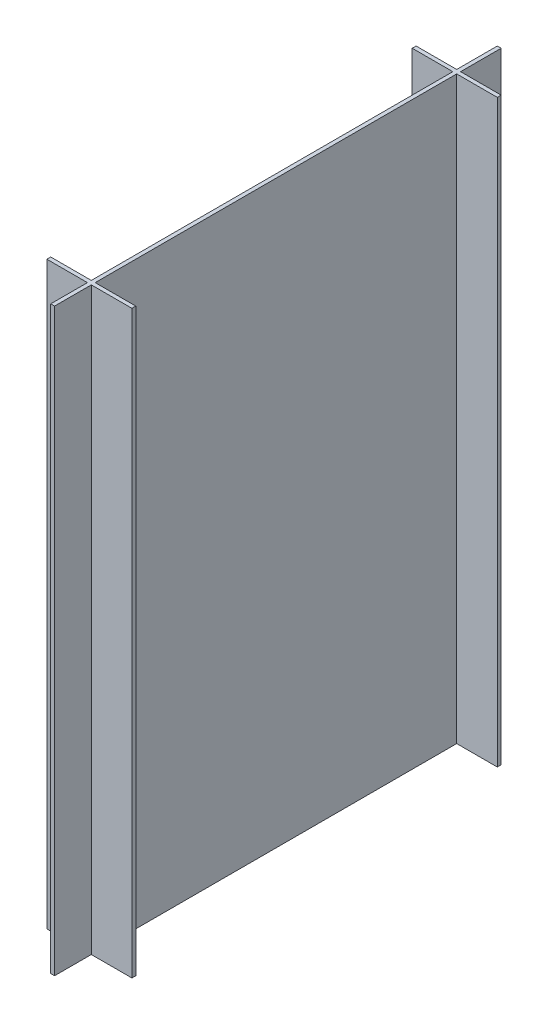
from build123d import *

# Parameters (mm, degrees)
BOSS_EXTRUDE1_DEPTH = 300


with BuildPart() as part:
    # Sketch1 → Boss-Extrude1 (new body)
    with BuildSketch(Plane(origin=(0, 0, 0), x_dir=(1, 0, 0), z_dir=(0, 1, 0))):
        Polygon((-56.161611152, -42.302266887), (-35.161611152, -42.302266887), (-35.161611152, -21.302266887), (-33.161611152, -21.302266887), (-33.161611152, -42.302266887), (-12.161611152, -42.302266887), (-12.161611152, -44.302266887), (-33.161611152, -44.302266887), (-33.161611152, -231.302266887), (-12.161611152, -231.302266887), (-12.161611152, -233.302266887), (-33.161611152, -233.302266887), (-33.161611152, -252.302266887), (-35.161611152, -252.302266887), (-35.161611152, -233.302266887), (-56.161611152, -233.302266887), (-56.161611152, -231.302266887), (-35.161611152, -231.302266887), (-35.161611152, -44.302266887), (-56.161611152, -44.302266887), align=None)
    extrude(amount=BOSS_EXTRUDE1_DEPTH)


solid = part.part
